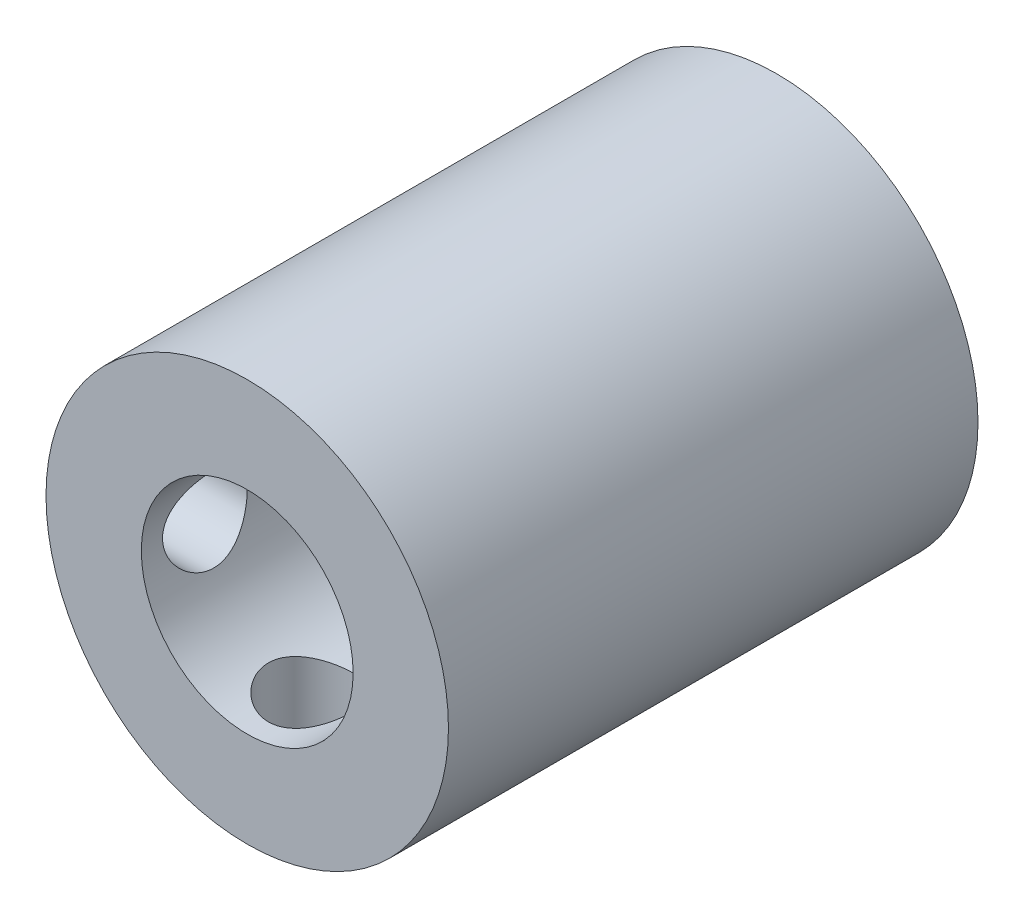
from build123d import *

# Parameters (mm, degrees)
SKETCH2_R           = 9.5
SKETCH2_R_2         = 2.5
BOSS_EXTRUDE1_DEPTH = 25
SKETCH3_R           = 5
CUT_EXTRUDE1_DEPTH  = 16.5
CUT_EXTRUDE2_DEPTH  = 16.5
SKETCH5_R           = 2
CUT_EXTRUDE3_DEPTH  = 9.5


with BuildPart() as part:
    # Sketch2 → Boss-Extrude1 (new body)
    with BuildSketch(Plane.XY):
        Circle(SKETCH2_R)
        Circle(SKETCH2_R_2, mode=Mode.SUBTRACT)
    extrude(amount=BOSS_EXTRUDE1_DEPTH)

    # Sketch3 → Cut-Extrude1 (cut)
    with BuildSketch(Plane.XY.offset(25)):
        Circle(SKETCH3_R)
    extrude(amount=-CUT_EXTRUDE1_DEPTH, mode=Mode.SUBTRACT)

    # Sketch4 → Cut-Extrude2 (cut)
    with BuildSketch(Plane(origin=(-15.41400196, 54.908076208, -53.970187191), x_dir=(0, 1, 0), z_dir=(1, 0, 0))):
        with BuildLine():
            ThreePointArc((-54.908076208, 58.970187191), (-56.908076208, 56.970187191), (-54.908076208, 54.970187191))
            Line((-54.908076208, 54.970187191), (-54.908076208, 58.970187191))
        make_face()
        with BuildLine():
            Line((-54.908076208, 58.970187191), (-54.908076208, 54.970187191))
            ThreePointArc((-54.908076208, 54.970187191), (-53.493862646, 55.555973629), (-52.908076208, 56.970187191))
            ThreePointArc((-52.908076208, 56.970187191), (-53.493862646, 58.384400753), (-54.908076208, 58.970187191))
        make_face()
        with BuildLine():
            ThreePointArc((-52.908076208, 75.970187191), (-53.493862646, 77.384400753), (-54.908076208, 77.970187191))
            Line((-54.908076208, 77.970187191), (-54.908076208, 73.970187191))
            ThreePointArc((-54.908076208, 73.970187191), (-53.493862646, 74.555973629), (-52.908076208, 75.970187191))
        make_face()
        with BuildLine():
            Line((-54.908076208, 73.970187191), (-54.908076208, 77.970187191))
            ThreePointArc((-54.908076208, 77.970187191), (-56.908076208, 75.970187191), (-54.908076208, 73.970187191))
        make_face()
    extrude(amount=CUT_EXTRUDE2_DEPTH, mode=Mode.SUBTRACT)

    # Sketch5 → Cut-Extrude3 (cut)
    with BuildSketch(Plane(origin=(-15.41400196, -10.091923792, -53.970187191), x_dir=(1, 0, 0), z_dir=(0, -1, 0))):
        with BuildLine():
            ThreePointArc((15.41400196, 58.970187191), (13.41400196, 56.970187191), (15.41400196, 54.970187191))
            Line((15.41400196, 54.970187191), (15.41400196, 58.970187191))
        make_face()
        with BuildLine():
            Line((15.41400196, 58.970187191), (15.41400196, 54.970187191))
            ThreePointArc((15.41400196, 54.970187191), (16.828215523, 55.555973629), (17.41400196, 56.970187191))
            ThreePointArc((17.41400196, 56.970187191), (16.828215523, 58.384400753), (15.41400196, 58.970187191))
        make_face()
        with Locations(Location((15.41400196, 75.970187191, 0), (0, 0, 270))):
            Circle(SKETCH5_R)
    extrude(amount=-CUT_EXTRUDE3_DEPTH, mode=Mode.SUBTRACT)


solid = part.part
